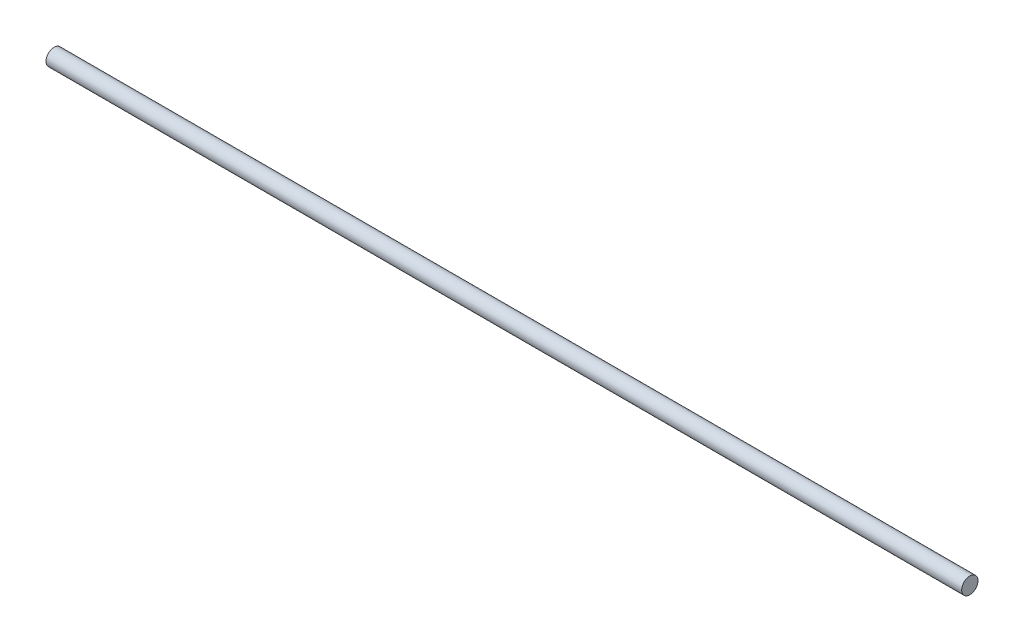
from build123d import *

# Parameters (mm, degrees)
SKETCH1_R           = 3.175
BOSS_EXTRUDE1_DEPTH = 356


with BuildPart() as part:
    # Sketch1 → Boss-Extrude1 (new body)
    with BuildSketch(Plane(origin=(0, 0, 0), x_dir=(0, 0, -1), z_dir=(1, 0, 0))):
        Circle(SKETCH1_R)
    extrude(amount=BOSS_EXTRUDE1_DEPTH)


solid = part.part
